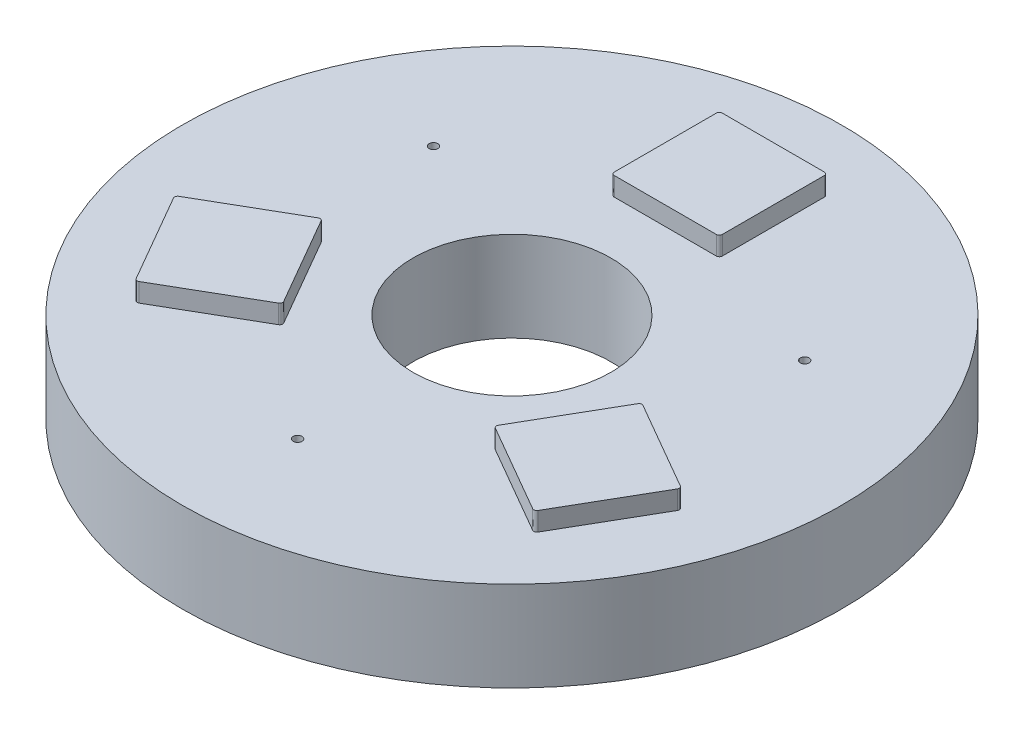
from build123d import *

# Parameters (mm, degrees)
SKETCH1_R            = 18
BOSS_EXTRUDE1_DEPTH  = 2.45505
SKETCH3_R            = 0.238865
SKETCH3_R_2          = 5.4101
CUT_EXTRUDE1_DEPTH   = 26.57395688
CIRPATTERN1_COUNT    = 3
BOSS_EXTRUDE2_DEPTH  = 1.0229375
CIRPATTERN2_COUNT    = 3
MIRROR1_COPY_1_DEPTH = 1.0229375
MIRROR1_COPY_2_DEPTH = 1.0229375


with BuildPart() as part:
    # Sketch1 → Boss-Extrude1 (new, symmetric)
    with BuildSketch(Plane(origin=(0, 0, 0), x_dir=(1, 0, 0), z_dir=(0, 1, 0))):
        with Locations(Location((0, 0, 0), (0, 0, 270))):
            Circle(SKETCH1_R)
    extrude(amount=BOSS_EXTRUDE1_DEPTH, both=True)

    # Sketch3 → Cut-Extrude1 (cut, symmetric)
    with BuildSketch(Plane(origin=(0, 0, 0), x_dir=(1, 0, 0), z_dir=(0, 1, 0))):
        with Locations(Location((0, -11.70505, 0), (0, 0, 270))):
            Circle(SKETCH3_R)
        with Locations(Location((0, 0, 0), (0, 0, 270))):
            Circle(SKETCH3_R_2)
    cut_extrude1 = extrude(amount=CUT_EXTRUDE1_DEPTH, both=True, mode=Mode.SUBTRACT)

    # CirPattern1: Cut-Extrude1 ×3 about axis
    cirpattern1_axis = Axis((0, 0, 0), (0, 1, 0))
    for i in range(1, CIRPATTERN1_COUNT):
        add(cut_extrude1.rotate(cirpattern1_axis, i * 360 / CIRPATTERN1_COUNT), mode=Mode.SUBTRACT)

    # Sketch5 → Boss-Extrude2 (add)
    with BuildSketch(Plane(origin=(0, 2.45505, 0), x_dir=(1, 0, 0), z_dir=(0, 1, 0))):
        with BuildLine():
            Line((-8.871171075, -1.714531368), (-13.698548779, -4.501619185))
            ThreePointArc((-13.698548779, -4.501619185), (-13.774806859, -4.60100065), (-13.758456157, -4.725196563))
            Line((-13.758456157, -4.725196563), (-10.97136834, -9.552574267))
            ThreePointArc((-10.97136834, -9.552574267), (-10.871986875, -9.628832347), (-10.747790962, -9.612481645))
            Line((-10.747790962, -9.612481645), (-5.920413258, -6.825393828))
            ThreePointArc((-5.920413258, -6.825393828), (-5.844155178, -6.726012363), (-5.86050588, -6.60181645))
            Line((-5.86050588, -6.60181645), (-8.647593697, -1.774438746))
            ThreePointArc((-8.647593697, -1.774438746), (-8.746975162, -1.698180666), (-8.871171075, -1.714531368))
        make_face()
    boss_extrude2 = extrude(amount=BOSS_EXTRUDE2_DEPTH)

    # CirPattern2: Boss-Extrude2 ×3 about axis
    cirpattern2_axis = Axis((0, 0, 0), (0, 1, 0))
    for i in range(1, CIRPATTERN2_COUNT):
        add(boss_extrude2.rotate(cirpattern2_axis, i * 360 / CIRPATTERN2_COUNT))

    # Mirror1: Boss-Extrude2 across plane
    add(boss_extrude2.mirror(Plane.ZX))

    # Mirror1 copy 1 sketch → Mirror1 copy 1 (add)
    with BuildSketch(Plane(origin=(0, -2.45505, 0), x_dir=(-0.4999999999999998, 0, -0.8660254037844387), z_dir=(0, -1, 0))):
        with BuildLine():
            Line((-8.871171075, 1.714531368), (-13.698548779, 4.501619185))
            ThreePointArc((-13.698548779, 4.501619185), (-13.774806859, 4.60100065), (-13.758456157, 4.725196563))
            Line((-13.758456157, 4.725196563), (-10.97136834, 9.552574267))
            ThreePointArc((-10.97136834, 9.552574267), (-10.871986875, 9.628832347), (-10.747790962, 9.612481645))
            Line((-10.747790962, 9.612481645), (-5.920413258, 6.825393828))
            ThreePointArc((-5.920413258, 6.825393828), (-5.844155178, 6.726012363), (-5.86050588, 6.60181645))
            Line((-5.86050588, 6.60181645), (-8.647593697, 1.774438746))
            ThreePointArc((-8.647593697, 1.774438746), (-8.746975162, 1.698180666), (-8.871171075, 1.714531368))
        make_face()
    extrude(amount=MIRROR1_COPY_1_DEPTH)

    # Mirror1 copy 2 sketch → Mirror1 copy 2 (add)
    with BuildSketch(Plane(origin=(0, -2.45505, 0), x_dir=(-0.5000000000000004, 0, 0.8660254037844384), z_dir=(0, -1, 0))):
        with BuildLine():
            Line((-8.871171075, 1.714531368), (-13.698548779, 4.501619185))
            ThreePointArc((-13.698548779, 4.501619185), (-13.774806859, 4.60100065), (-13.758456157, 4.725196563))
            Line((-13.758456157, 4.725196563), (-10.97136834, 9.552574267))
            ThreePointArc((-10.97136834, 9.552574267), (-10.871986875, 9.628832347), (-10.747790962, 9.612481645))
            Line((-10.747790962, 9.612481645), (-5.920413258, 6.825393828))
            ThreePointArc((-5.920413258, 6.825393828), (-5.844155178, 6.726012363), (-5.86050588, 6.60181645))
            Line((-5.86050588, 6.60181645), (-8.647593697, 1.774438746))
            ThreePointArc((-8.647593697, 1.774438746), (-8.746975162, 1.698180666), (-8.871171075, 1.714531368))
        make_face()
    extrude(amount=MIRROR1_COPY_2_DEPTH)


solid = part.part
